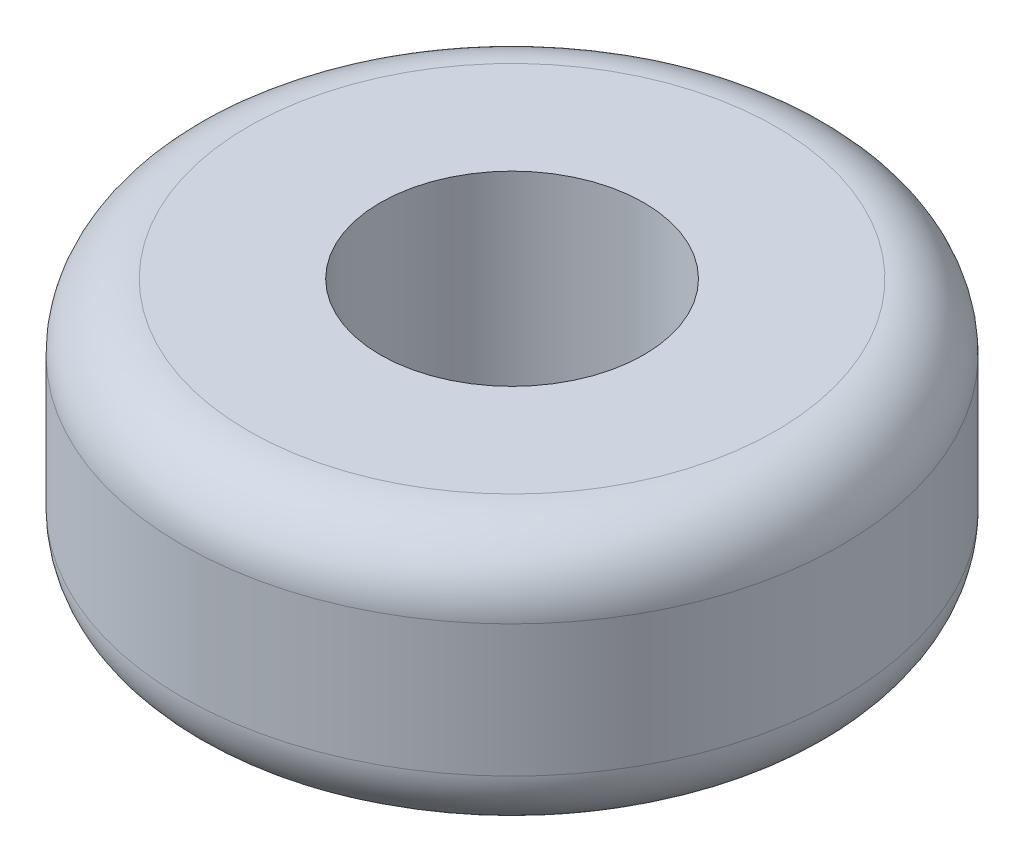
from build123d import *

# Parameters (mm, degrees)
SKETCH1_R           = 31.75
BOSS_EXTRUDE1_DEPTH = 25.4
SKETCH2_R           = 12.7
CUT_EXTRUDE1_DEPTH  = 52.587643869
FILLET1_R           = 6.35


with BuildPart() as part:
    # Sketch1 → Boss-Extrude1 (new body)
    with BuildSketch(Plane(origin=(0, 0, 0), x_dir=(1, 0, 0), z_dir=(0, 1, 0))):
        with Locations(Location((0, 0, 0), (0, 0, 270))):
            Circle(SKETCH1_R)
    extrude(amount=BOSS_EXTRUDE1_DEPTH)

    # Sketch2 → Cut-Extrude1 (cut, through all)
    with BuildSketch(Plane(origin=(0, 25.4, 0), x_dir=(1, 0, 0), z_dir=(0, 1, 0))):
        with Locations(Location((0, 0, 0), (0, 0, 270))):
            Circle(SKETCH2_R)
    extrude(amount=-CUT_EXTRUDE1_DEPTH, mode=Mode.SUBTRACT)

    # Fillet1
    fillet1_edges = [part.edges().sort_by_distance(p)[0] for p in [
        (0, 0, -31.75),
        (0, 25.4, -31.75),
    ]]
    fillet(fillet1_edges, radius=FILLET1_R)


solid = part.part
